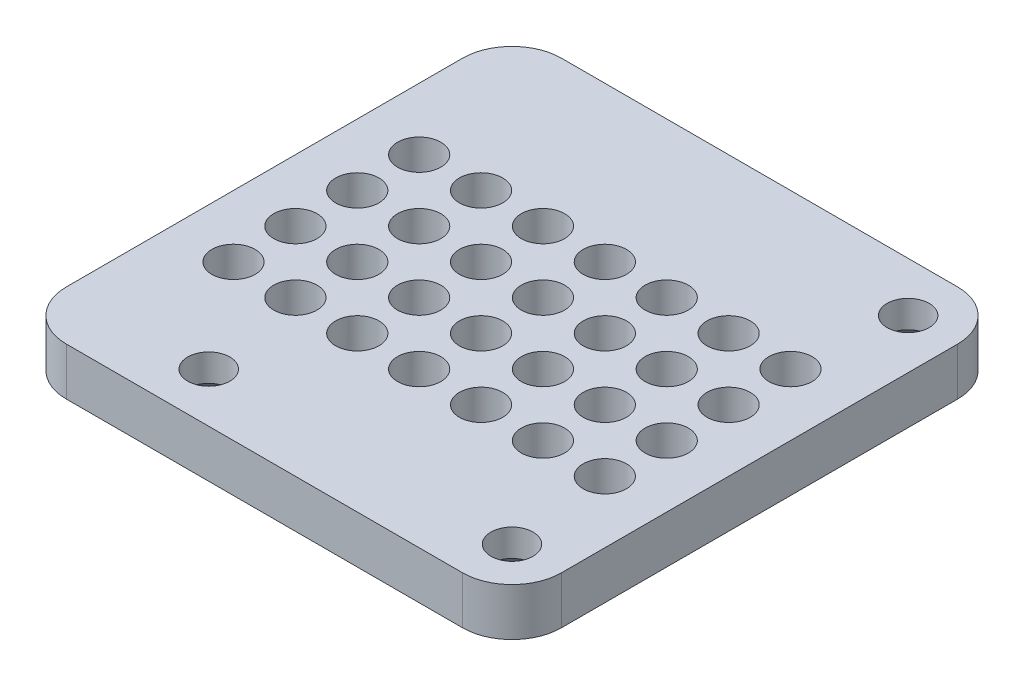
from build123d import *

# Parameters (mm, degrees)
SKETCH1_R                                           = 1.6
BOSS_EXTRUDE1_DEPTH                                 = 3.85
CSK_FOR_M3_COUNTERSUNK_FLAT_HEAD_SCREW1_D           = 3.4
CSK_FOR_M3_COUNTERSUNK_FLAT_HEAD_SCREW1_CSINK_D     = 6.7
CSK_FOR_M3_COUNTERSUNK_FLAT_HEAD_SCREW1_CSINK_ANGLE = 90
SKETCH4_R                                           = 1.75
CUT_EXTRUDE1_DEPTH                                  = 12.5


with BuildPart() as part:
    # Sketch1 → Boss-Extrude1 (new body)
    with BuildSketch(Plane(origin=(0, 0, 0), x_dir=(1, 0, 0), z_dir=(0, 1, 0))):
        with BuildLine():
            Line((4, 0), (36, 0))
            ThreePointArc((36, 0), (38.828427125, 1.171572875), (40, 4))
            Line((40, 4), (40, 36))
            ThreePointArc((40, 36), (38.828427125, 38.828427125), (36, 40))
            Line((36, 40), (4, 40))
            ThreePointArc((4, 40), (1.171572875, 38.828427125), (0, 36))
            Line((0, 36), (0, 4))
            ThreePointArc((0, 4), (1.171572875, 1.171572875), (4, 0))
        make_face()
        with Locations(Location((11.5, 4, 0), (0, 0, 90))):
            Circle(SKETCH1_R, mode=Mode.SUBTRACT)
        with Locations(Location((36, 4, 0), (0, 0, 90))):
            Circle(SKETCH1_R, mode=Mode.SUBTRACT)
        with Locations(Location((36, 36, 0), (0, 0, 90))):
            Circle(SKETCH1_R, mode=Mode.SUBTRACT)
    extrude(amount=BOSS_EXTRUDE1_DEPTH)

    # CSK for M3 Countersunk Flat Head Screw1 (through all)
    with Locations(Plane(origin=(0, 0, 0), x_dir=(-1, 0, 0), z_dir=(0, -1, 0))):
        with Locations((-11.5, 4), (-36, 4), (-36, 36)):
            CounterSinkHole(CSK_FOR_M3_COUNTERSUNK_FLAT_HEAD_SCREW1_D / 2, CSK_FOR_M3_COUNTERSUNK_FLAT_HEAD_SCREW1_CSINK_D / 2, counter_sink_angle=CSK_FOR_M3_COUNTERSUNK_FLAT_HEAD_SCREW1_CSINK_ANGLE)

    # Sketch4 → Cut-Extrude1 (cut)
    with BuildSketch(Plane(origin=(0, 3.85, 0), x_dir=(1, 0, 0), z_dir=(0, 1, 0))):
        with Locations(Location((5, 22.5, 0), (0, 0, 270))):
            Circle(SKETCH4_R)
        with Locations(Location((10, 22.5, 0), (0, 0, 270))):
            Circle(SKETCH4_R)
        with Locations(Location((5, 17.5, 0), (0, 0, 270))):
            Circle(SKETCH4_R)
        with Locations(Location((10, 17.5, 0), (0, 0, 270))):
            Circle(SKETCH4_R)
        with Locations(Location((30, 17.5, 0), (0, 0, 90))):
            Circle(SKETCH4_R)
        with Locations(Location((35, 17.5, 0), (0, 0, 90))):
            Circle(SKETCH4_R)
        with Locations(Location((30, 22.5, 0), (0, 0, 90))):
            Circle(SKETCH4_R)
        with Locations(Location((35, 22.5, 0), (0, 0, 90))):
            Circle(SKETCH4_R)
        with Locations(Location((15, 22.5, 0), (0, 0, 270))):
            Circle(SKETCH4_R)
        with Locations(Location((15, 17.5, 0), (0, 0, 270))):
            Circle(SKETCH4_R)
        with Locations(Location((20, 22.5, 0), (0, 0, 270))):
            Circle(SKETCH4_R)
        with Locations(Location((20, 17.5, 0), (0, 0, 270))):
            Circle(SKETCH4_R)
        with Locations(Location((25, 22.5, 0), (0, 0, 270))):
            Circle(SKETCH4_R)
        with Locations(Location((25, 17.5, 0), (0, 0, 270))):
            Circle(SKETCH4_R)
        with Locations(Location((5, 27.5, 0), (0, 0, 270))):
            Circle(SKETCH4_R)
        with Locations(Location((10, 27.5, 0), (0, 0, 270))):
            Circle(SKETCH4_R)
        with Locations(Location((30, 27.5, 0), (0, 0, 90))):
            Circle(SKETCH4_R)
        with Locations(Location((35, 27.5, 0), (0, 0, 90))):
            Circle(SKETCH4_R)
        with Locations(Location((15, 27.5, 0), (0, 0, 270))):
            Circle(SKETCH4_R)
        with Locations(Location((20, 27.5, 0), (0, 0, 270))):
            Circle(SKETCH4_R)
        with Locations(Location((25, 27.5, 0), (0, 0, 270))):
            Circle(SKETCH4_R)
        with Locations(Location((5, 12.5, 0), (0, 0, 270))):
            Circle(SKETCH4_R)
        with Locations(Location((10, 12.5, 0), (0, 0, 270))):
            Circle(SKETCH4_R)
        with Locations(Location((30, 12.5, 0), (0, 0, 90))):
            Circle(SKETCH4_R)
        with Locations(Location((35, 12.5, 0), (0, 0, 90))):
            Circle(SKETCH4_R)
        with Locations(Location((15, 12.5, 0), (0, 0, 270))):
            Circle(SKETCH4_R)
        with Locations(Location((20, 12.5, 0), (0, 0, 270))):
            Circle(SKETCH4_R)
        with Locations(Location((25, 12.5, 0), (0, 0, 270))):
            Circle(SKETCH4_R)
    extrude(amount=-CUT_EXTRUDE1_DEPTH, mode=Mode.SUBTRACT)


solid = part.part
